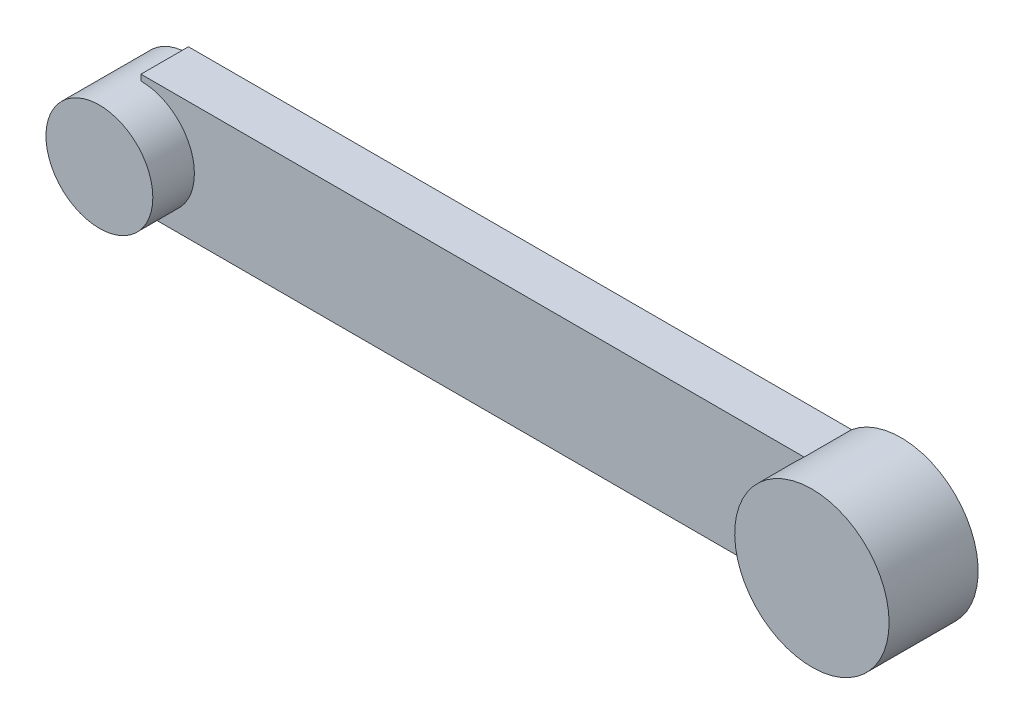
from build123d import *

# Parameters (mm, degrees)
SKETCH_1_W      = 120000
SKETCH_1_H      = 20000
EXTRUDE_1_DEPTH = 8000
SKETCH_2_R      = 9000
EXTRUDE_2_DEPTH = 15000
SKETCH_3_R      = 13000
EXTRUDE_3_DEPTH = 15000


with BuildPart() as part:
    # 草图1 → 凸台-拉伸1 (new body)
    with BuildSketch(Plane.XY):
        with Locations((170000, 115000)):
            Rectangle(SKETCH_1_W, SKETCH_1_H)
    extrude(amount=EXTRUDE_1_DEPTH)

    # 草图2 → 凸台-拉伸2 (add)
    with BuildSketch(Plane.XY):
        with Locations(Location((110000, 115000, 0), (0, 0, 270))):
            Circle(SKETCH_2_R)
    extrude(amount=EXTRUDE_2_DEPTH)

    # 草图3 → 凸台-拉伸3 (add)
    with BuildSketch(Plane.XY):
        with Locations(Location((230000, 115000, 0), (0, 0, 230.284862768))):
            Circle(SKETCH_3_R)
    extrude(amount=EXTRUDE_3_DEPTH)


solid = part.part
